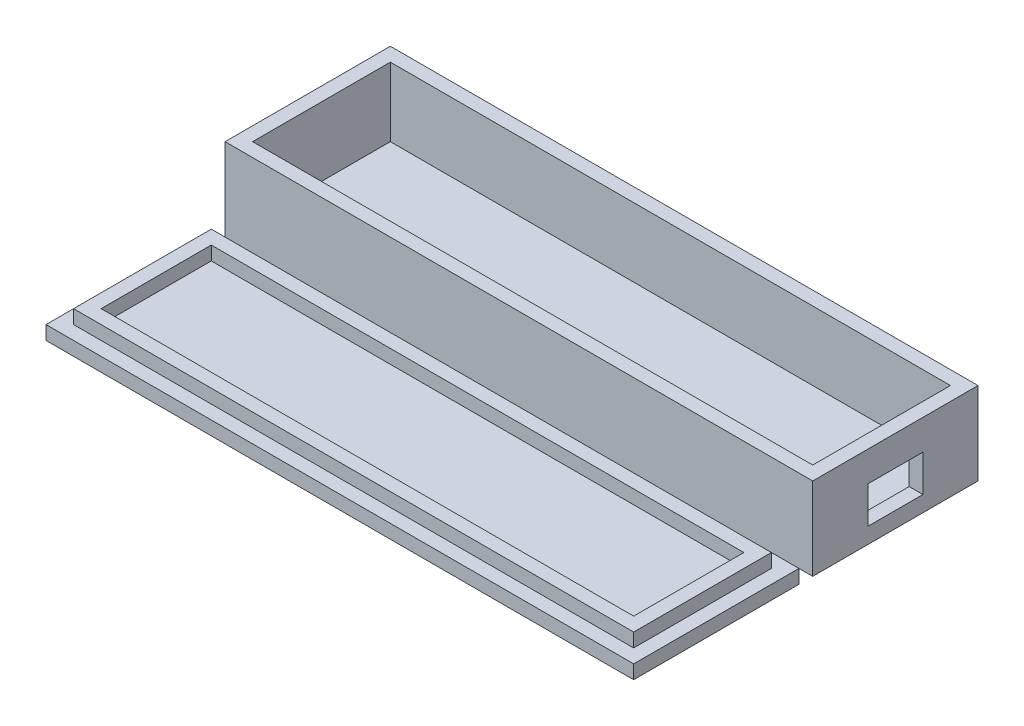
from build123d import *

# Parameters (mm, degrees)
CROQUIS1_W              = 128
CROQUIS1_H              = 36
SALIENTE_EXTRUIR1_DEPTH = 3
CROQUIS3_W              = 128
CROQUIS3_H              = 36
CROQUIS3_W_2            = 122
CROQUIS3_H_2            = 30
SALIENTE_EXTRUIR2_DEPTH = 15
CROQUIS4_W              = 12
CROQUIS4_H              = 8
CORTAR_EXTRUIR1_DEPTH   = 12
CROQUIS6_W              = 128
CROQUIS6_H              = 36
SALIENTE_EXTRUIR3_DEPTH = 3
CROQUIS7_W              = 122
CROQUIS7_H              = 30
CROQUIS7_W_2            = 116
CROQUIS7_H_2            = 24
SALIENTE_EXTRUIR5_DEPTH = 3


with BuildPart() as part:
    # Croquis1 → Saliente-Extruir1 (new body)
    with BuildSketch(Plane(origin=(0, 0, 0), x_dir=(1, 0, 0), z_dir=(0, 1, 0))):
        Rectangle(CROQUIS1_W, CROQUIS1_H)
    extrude(amount=SALIENTE_EXTRUIR1_DEPTH)

    # Croquis3 → Saliente-Extruir2 (add)
    with BuildSketch(Plane(origin=(0, 3, 0), x_dir=(1, 0, 0), z_dir=(0, 1, 0))):
        Rectangle(CROQUIS3_W, CROQUIS3_H)
        Rectangle(CROQUIS3_W_2, CROQUIS3_H_2, mode=Mode.SUBTRACT)
    extrude(amount=SALIENTE_EXTRUIR2_DEPTH)

    # Croquis4 → Cortar-Extruir1 (cut)
    with BuildSketch(Plane(origin=(64, 0, 0), x_dir=(0, 0, -1), z_dir=(1, 0, 0))):
        with Locations((0, 7.438354728)):
            Rectangle(CROQUIS4_W, CROQUIS4_H)
    extrude(amount=-CORTAR_EXTRUIR1_DEPTH, mode=Mode.SUBTRACT)


with BuildPart() as body_2:
    # Croquis6 → Saliente-Extruir3 (new body)
    with BuildSketch(Plane(origin=(0, 0, 0), x_dir=(1, 0, 0), z_dir=(0, 1, 0))):
        with Locations((0, -39)):
            Rectangle(CROQUIS6_W, CROQUIS6_H)
    extrude(amount=SALIENTE_EXTRUIR3_DEPTH)

    # Croquis7 → Saliente-Extruir5 (add)
    with BuildSketch(Plane(origin=(0, 3, 0), x_dir=(1, 0, 0), z_dir=(0, 1, 0))):
        with Locations((0, -39)):
            Rectangle(CROQUIS7_W, CROQUIS7_H)
        with Locations((0, -39)):
            Rectangle(CROQUIS7_W_2, CROQUIS7_H_2, mode=Mode.SUBTRACT)
    extrude(amount=SALIENTE_EXTRUIR5_DEPTH)


solid = Compound([part.part, body_2.part])
